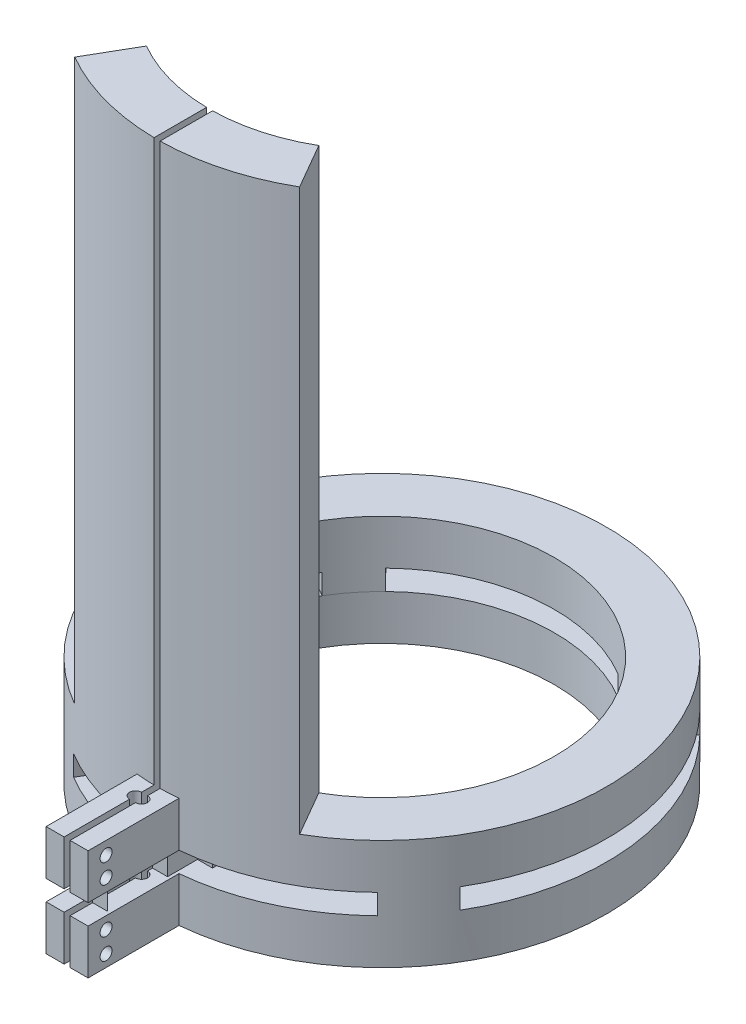
from build123d import *
from build123d.topology import SkipClean

# Parameters (mm, degrees)
SKETCH1_R                = 75
SKETCH1_R_2              = 57.5
BOSS_EXTRUDE1_DEPTH      = 15
BOSS_EXTRUDE2_DEPTH      = 30
BOSS_EXTRUDE2_DEPTH_BACK = 5
SKETCH2_W                = 14
SKETCH2_H                = 15
SKETCH5_W                = 2
SKETCH5_H                = 47.50869631
CUT_EXTRUDE2_DEPTH       = 64
SKETCH6_R                = 2
CUT_EXTRUDE3_DEPTH       = 64
BOSS_EXTRUDE3_DEPTH      = 6.75
BOSS_EXTRUDE4_START      = 15
BOSS_EXTRUDE4_DEPTH      = 15
SKETCH10_R               = 2
CUT_EXTRUDE5_DEPTH       = 135.989119932
SKETCH11_W               = 20
SKETCH11_H               = 6.75
CUT_EXTRUDE6_DEPTH       = 135.384011326
BOSS_EXTRUDE5_DEPTH      = 6.75
CUT_EXTRUDE8_DEPTH       = 135.166174947
BOSS_EXTRUDE6_DEPTH      = 187


with BuildPart() as part:
    # Sketch1 → Boss-Extrude1 (new body)
    with BuildSketch(Plane(origin=(0, 0, 0), x_dir=(1, 0, 0), z_dir=(0, 1, 0))):
        with Locations(Location((0, 0, 0), (0, 0, 270))):
            Circle(SKETCH1_R)
        with Locations(Location((0, 0, 0), (0, 0, 270))):
            Circle(SKETCH1_R_2, mode=Mode.SUBTRACT)
    extrude(amount=BOSS_EXTRUDE1_DEPTH)

    # Sketch2 → Boss-Extrude2 (add, two sides: drawn at the far end of the back side and taken through both)
    with BuildSketch(Plane.XY.offset(75).offset(-BOSS_EXTRUDE2_DEPTH_BACK)):
        with Locations((0, 7.5)):
            Rectangle(SKETCH2_W, SKETCH2_H)
    extrude(amount=BOSS_EXTRUDE2_DEPTH + BOSS_EXTRUDE2_DEPTH_BACK)

    # Sketch5 → Cut-Extrude2 (cut)
    with BuildSketch(Plane.XZ):
        with Locations((0, 81.245651845)):
            Rectangle(SKETCH5_W, SKETCH5_H)
    extrude(amount=-CUT_EXTRUDE2_DEPTH, mode=Mode.SUBTRACT)

    # Sketch6 → Cut-Extrude3 (cut)
    with BuildSketch(Plane(origin=(7, 0, 0), x_dir=(0, 0, -1), z_dir=(1, 0, 0))):
        with Locations(Location((-99, 4.25, 0), (0, 0, 90))):
            Circle(SKETCH6_R)
        with Locations(Location((-99, 10.75, 0), (0, 0, 90))):
            Circle(SKETCH6_R)
    extrude(amount=-CUT_EXTRUDE3_DEPTH, mode=Mode.SUBTRACT)

    # Sketch7 → Boss-Extrude3 (add)
    with BuildSketch(Plane.XZ):
        Polygon((1, 67.497826046), (1, 57.497826046), (11, 57.497826046), (11, 67.497826046), (6, 67.497826046), (6, 97.497826046), (1, 97.497826046), align=None)
        Polygon((-6, 67.49130369), (-6, 97.49130369), (-1, 97.49130369), (-1, 57.49130369), (-10.5, 57.49130369), (-10.5, 67.49130369), align=None)
    extrude(amount=BOSS_EXTRUDE3_DEPTH)

    # Sketch8 → Boss-Extrude4 (add)
    with BuildSketch(Plane.XZ.offset(6.75).offset(BOSS_EXTRUDE4_START)):
        with BuildLine():
            Line((-1, 57.50434569), (-1, 105))
            Line((-1, 105), (-7, 105))
            Line((-7, 105), (-7, 74.67261881))
            ThreePointArc((-7, 74.67261881), (0, -75), (7, 74.67261881))
            Line((7, 74.67261881), (7, 105))
            Line((7, 105), (1, 105))
            Line((1, 105), (1, 57.50434569))
            ThreePointArc((1, 57.50434569), (0, -57.513040028), (-1, 57.50434569))
        make_face()
    extrude(amount=-BOSS_EXTRUDE4_DEPTH)

    # Sketch10 → Cut-Extrude5 (cut, through all)
    with BuildSketch(Plane.ZY.offset(7)):
        with Locations((99, -10.75)):
            Circle(SKETCH10_R)
        with Locations((99, -17.75)):
            Circle(SKETCH10_R)
    extrude(amount=-CUT_EXTRUDE5_DEPTH, mode=Mode.SUBTRACT)

    # Sketch11 → Cut-Extrude6 (cut, through all)
    with BuildSketch(Plane.ZY.offset(6)):
        with Locations((87.49130369, -3.375)):
            Rectangle(SKETCH11_W, SKETCH11_H)
    extrude(amount=-CUT_EXTRUDE6_DEPTH, mode=Mode.SUBTRACT)

    # Sketch12 → Boss-Extrude5 (add)
    with SkipClean():  # the faces are left unmerged after this step: merging them gives an invalid solid
        with BuildSketch(Plane(origin=(0, -6.75, 0), x_dir=(1, 0, 0), z_dir=(0, 1, 0))):
            with BuildLine():
                Line((52.286531011, -53.769123806), (40.086340442, -41.222994918))
                ThreePointArc((40.086340442, -41.222994918), (45.124076801, -35.638009104), (49.389727695, -29.443247073))
                Line((49.389727695, -29.443247073), (64.42138395, -38.404235313))
                ThreePointArc((64.42138395, -38.404235313), (58.857491479, -46.484359701), (52.286531011, -53.769123806))
            make_face()
            with BuildLine():
                Line((-53.769123806, -52.286531011), (-41.222994918, -40.086340442))
                ThreePointArc((-41.222994918, -40.086340442), (-35.638009104, -45.124076801), (-29.443247073, -49.389727695))
                Line((-29.443247073, -49.389727695), (-38.404235313, -64.42138395))
                ThreePointArc((-38.404235313, -64.42138395), (-46.484359701, -58.857491479), (-53.769123806, -52.286531011))
            make_face()
            with BuildLine():
                Line((-52.286531011, 53.769123806), (-40.086340442, 41.222994918))
                ThreePointArc((-40.086340442, 41.222994918), (-45.124076801, 35.638009104), (-49.389727695, 29.443247073))
                Line((-49.389727695, 29.443247073), (-64.42138395, 38.404235313))
                ThreePointArc((-64.42138395, 38.404235313), (-58.857491479, 46.484359701), (-52.286531011, 53.769123806))
            make_face()
            with BuildLine():
                Line((53.769123806, 52.286531011), (41.222994918, 40.086340442))
                ThreePointArc((41.222994918, 40.086340442), (35.638009104, 45.124076801), (29.443247073, 49.389727695))
                Line((29.443247073, 49.389727695), (38.404235313, 64.42138395))
                ThreePointArc((38.404235313, 64.42138395), (46.484359701, 58.857491479), (53.769123806, 52.286531011))
            make_face()
        extrude(amount=BOSS_EXTRUDE5_DEPTH)

    # Sketch15 → Cut-Extrude8 (cut, through all)
    with SkipClean():  # the faces are left unmerged after this step: merging them gives an invalid solid
        with BuildSketch(Plane(origin=(0, 15, 0), x_dir=(1, 0, 0), z_dir=(0, 1, 0))):
            with BuildLine():
                Line((-1, -83.17261881), (-1, -79.17261881))
                ThreePointArc((-1, -79.17261881), (-3, -81.17261881), (-1, -83.17261881))
            make_face()
            with BuildLine():
                Line((1, -83.17261881), (1, -79.17261881))
                ThreePointArc((1, -79.17261881), (3, -81.17261881), (1, -83.17261881))
            make_face()
        extrude(amount=-CUT_EXTRUDE8_DEPTH, mode=Mode.SUBTRACT)

    # Sketch16 → Boss-Extrude6 (add)
    with BuildSketch(Plane(origin=(0, 15, 0), x_dir=(1, 0, 0), z_dir=(0, 1, 0))):
        with BuildLine():
            Line((-1, -74.993333037), (-1, -57.49130369))
            ThreePointArc((-1, -57.49130369), (-15.364513565, -55.409220559), (-28.75, -49.796460718))
            Line((-28.75, -49.796460718), (-37.5, -64.951905284))
            ThreePointArc((-37.5, -64.951905284), (-19.89397064, -72.313414607), (-1, -74.993333037))
        make_face()
        with BuildLine():
            Line((1, -74.993333037), (1, -57.49130369))
            ThreePointArc((1, -57.49130369), (15.364513565, -55.409220559), (28.75, -49.796460718))
            Line((28.75, -49.796460718), (37.5, -64.951905284))
            ThreePointArc((37.5, -64.951905284), (19.89397064, -72.313414607), (1, -74.993333037))
        make_face()
    extrude(amount=BOSS_EXTRUDE6_DEPTH)


solid = part.part
